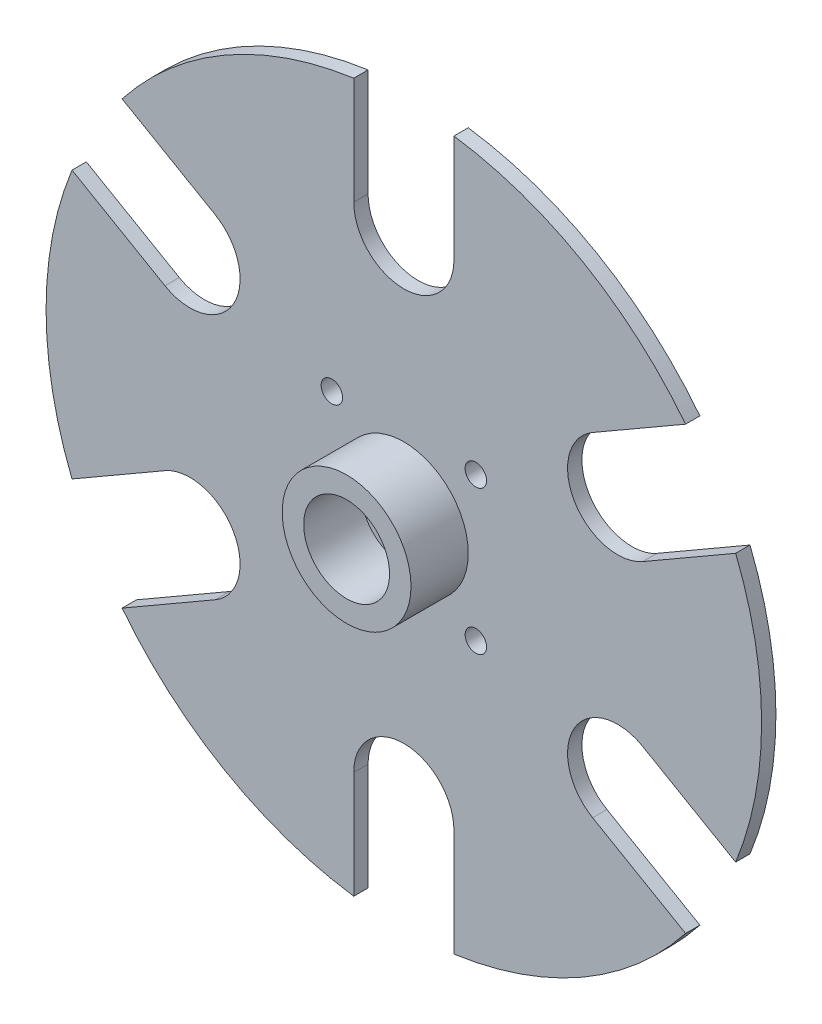
from build123d import *

# Parameters (mm, degrees)
SKETCH1_R               = 20
SKETCH1_R_2             = 6
SKETCH1_R_3             = 1.5
BOSS_EXTRUDE1_DEPTH     = 5
SKETCH2_R               = 9
SKETCH2_R_2             = 6
BOSS_EXTRUDE2_DEPTH     = 10
SKETCH3_R               = 50
BOSS_EXTRUDE3_DEPTH     = 2
CUT_EXTRUDE1_START      = -2
CUT_EXTRUDE1_DEPTH      = 2
CUT_EXTRUDE2_DEPTH      = 72.944422994
CUT_EXTRUDE2_DEPTH_BACK = 72.944422994
SKETCH5_R               = 1.5


with BuildPart() as part:
    # Sketch1 → Boss-Extrude1 (new body)
    with BuildSketch(Plane.XY):
        Circle(SKETCH1_R)
        Circle(SKETCH1_R_2, mode=Mode.SUBTRACT)
        with Locations((-10.061951403, 10.061951403)):
            Circle(SKETCH1_R_3, mode=Mode.SUBTRACT)
        with Locations(Location((10.061951403, 10.061951403, 0), (0, 0, 180))):
            Circle(SKETCH1_R_3, mode=Mode.SUBTRACT)
        with Locations((10.061951403, -10.061951403)):
            Circle(SKETCH1_R_3, mode=Mode.SUBTRACT)
        with Locations(Location((-10.061951403, -10.061951403, 0), (0, 0, 180))):
            Circle(SKETCH1_R_3, mode=Mode.SUBTRACT)
    extrude(amount=BOSS_EXTRUDE1_DEPTH)

    # Sketch2 → Boss-Extrude2 (add)
    with BuildSketch(Plane.XY.offset(5)):
        Circle(SKETCH2_R)
        Circle(SKETCH2_R_2, mode=Mode.SUBTRACT)
    extrude(amount=BOSS_EXTRUDE2_DEPTH)

    # Sketch3 → Boss-Extrude3 (add)
    with BuildSketch(Plane.XY.offset(5)):
        Circle(SKETCH3_R)
    extrude(amount=BOSS_EXTRUDE3_DEPTH)

    # Sketch4 → Cut-Extrude1 (cut)
    with BuildSketch(Plane.XY.offset(7).offset(CUT_EXTRUDE1_START)):
        with BuildLine():
            Line((-7, 49.507575178), (-7, 34.507575178))
            ThreePointArc((-7, 34.507575178), (0, 27.507575178), (7, 34.507575178))
            Line((7, 34.507575178), (7, 49.507575178))
            ThreePointArc((7, 49.507575178), (0, 50), (-7, 49.507575178))
        make_face()
        with BuildLine():
            Line((39.374817784, 30.815965415), (26.384436727, 23.315965415))
            ThreePointArc((26.384436727, 23.315965415), (23.822258901, 13.753787589), (33.384436727, 11.191609762))
            Line((33.384436727, 11.191609762), (46.374817784, 18.691609762))
            ThreePointArc((46.374817784, 18.691609762), (43.301270189, 25), (39.374817784, 30.815965415))
        make_face()
        with BuildLine():
            Line((46.374817784, -18.691609762), (33.384436727, -11.191609762))
            ThreePointArc((33.384436727, -11.191609762), (23.822258901, -13.753787589), (26.384436727, -23.315965415))
            Line((26.384436727, -23.315965415), (39.374817784, -30.815965415))
            ThreePointArc((39.374817784, -30.815965415), (43.301270189, -25), (46.374817784, -18.691609762))
        make_face()
        with BuildLine():
            Line((7, -49.507575178), (7, -34.507575178))
            ThreePointArc((7, -34.507575178), (0, -27.507575178), (-7, -34.507575178))
            Line((-7, -34.507575178), (-7, -49.507575178))
            ThreePointArc((-7, -49.507575178), (0, -50), (7, -49.507575178))
        make_face()
        with BuildLine():
            Line((-39.374817784, -30.815965415), (-26.384436727, -23.315965415))
            ThreePointArc((-26.384436727, -23.315965415), (-23.822258901, -13.753787589), (-33.384436727, -11.191609762))
            Line((-33.384436727, -11.191609762), (-46.374817784, -18.691609762))
            ThreePointArc((-46.374817784, -18.691609762), (-43.301270189, -25), (-39.374817784, -30.815965415))
        make_face()
        with BuildLine():
            Line((-46.374817784, 18.691609762), (-33.384436727, 11.191609762))
            ThreePointArc((-33.384436727, 11.191609762), (-23.822258901, 13.753787589), (-26.384436727, 23.315965415))
            Line((-26.384436727, 23.315965415), (-39.374817784, 30.815965415))
            ThreePointArc((-39.374817784, 30.815965415), (-43.301270189, 25), (-46.374817784, 18.691609762))
        make_face()
    extrude(amount=CUT_EXTRUDE1_DEPTH, mode=Mode.SUBTRACT)

    # Sketch5 → Cut-Extrude2 (cut, two sides: drawn at the far end of the back side and taken through both)
    with BuildSketch(Plane(origin=(0, 0, 0), x_dir=(-1, 0, 0), z_dir=(0, 0, -1)).offset(-CUT_EXTRUDE2_DEPTH_BACK)):
        with Locations((-10.061951403, 10.061951403)):
            Circle(SKETCH5_R)
        with Locations(Location((-10.061951403, -10.061951403, 0), (0, 0, 180))):
            Circle(SKETCH5_R)
        with Locations(Location((10.061951403, 10.061951403, 0), (0, 0, 180))):
            Circle(SKETCH5_R)
        with Locations((10.061951403, -10.061951403)):
            Circle(SKETCH5_R)
    extrude(amount=CUT_EXTRUDE2_DEPTH + CUT_EXTRUDE2_DEPTH_BACK, mode=Mode.SUBTRACT)


solid = part.part
